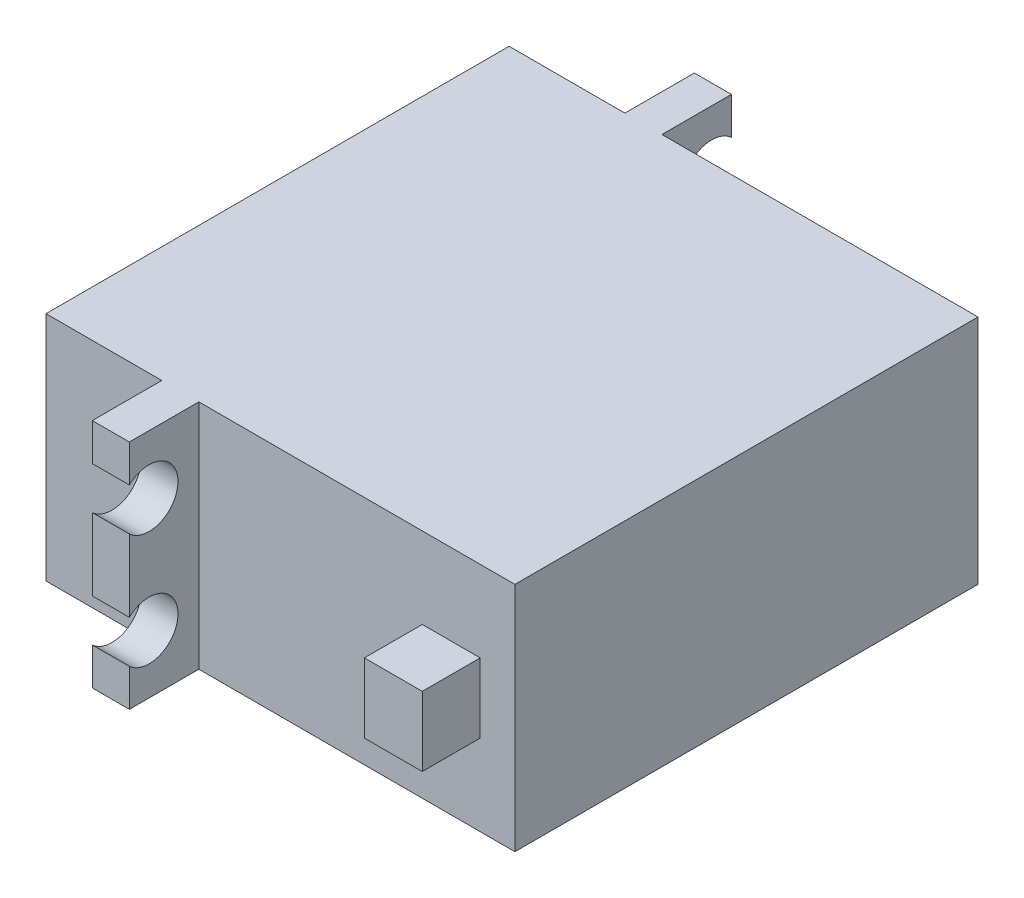
from build123d import *

# Parameters (mm, degrees)
BOSS_EXTRUDE1_START = 20.25
SKETCH2_W           = 40
SKETCH2_H           = 20
SKETCH2_R           = 3
BOSS_EXTRUDE1_DEPTH = 40.5
BOSS_EXTRUDE2_START = -7.05
BOSS_EXTRUDE2_DEPTH = 3.2
BOSS_EXTRUDE3_START = -20.25
SKETCH2_5_R         = 3
BOSS_EXTRUDE3_DEPTH = 5.5
SKETCH3_W           = 5
SKETCH3_H           = 6
BOSS_EXTRUDE4_DEPTH = 5


with BuildPart() as part:
    # Sketch2 → Boss-Extrude1 (new body)
    # profile 1 of 2: a face of its own
    with BuildSketch(Plane(origin=(0, 0, 0), x_dir=(0, 0, -1), z_dir=(1, 0, 0)).offset(BOSS_EXTRUDE1_START)):
        Rectangle(SKETCH2_W, SKETCH2_H)
        with Locations((-10.2, 0)):
            Circle(SKETCH2_R, mode=Mode.SUBTRACT)
    # profile 2 of 2: a face of its own
    with BuildSketch(Plane(origin=(0, 0, 0), x_dir=(0, 0, -1), z_dir=(1, 0, 0)).offset(BOSS_EXTRUDE1_START)):
        with Locations((-10.2, 0)):
            Circle(SKETCH2_R)
    extrude(amount=-BOSS_EXTRUDE1_DEPTH)

    # Sketch2<3> → Boss-Extrude2 (add)
    with BuildSketch(Plane(origin=(0, 0, 0), x_dir=(0, 0, -1), z_dir=(1, 0, 0)).offset(BOSS_EXTRUDE2_START)):
        with BuildLine():
            Line((-26, -10), (-20, -10))
            Line((-20, -10), (-20, 10))
            Line((-20, 10), (-26, 10))
            Line((-26, 10), (-26, 6.783030278))
            ThreePointArc((-26, 6.783030278), (-21.8, 4.95), (-26, 3.116969722))
            Line((-26, 3.116969722), (-26, -3.116969722))
            ThreePointArc((-26, -3.116969722), (-21.8, -4.95), (-26, -6.783030278))
            Line((-26, -6.783030278), (-26, -10))
        make_face()
        with BuildLine():
            Line((20, 10), (20, -10))
            Line((20, -10), (26, -10))
            Line((26, -10), (26, -6.783030278))
            ThreePointArc((26, -6.783030278), (21.8, -4.95), (26, -3.116969722))
            Line((26, -3.116969722), (26, 3.116969722))
            ThreePointArc((26, 3.116969722), (21.8, 4.95), (26, 6.783030278))
            Line((26, 6.783030278), (26, 10))
            Line((26, 10), (20, 10))
        make_face()
    extrude(amount=-BOSS_EXTRUDE2_DEPTH)

    # Sketch2<5> → Boss-Extrude3 (add)
    with BuildSketch(Plane(origin=(0, 0, 0), x_dir=(0, 0, -1), z_dir=(1, 0, 0)).offset(BOSS_EXTRUDE3_START)):
        with Locations((-10.2, 0)):
            Circle(SKETCH2_5_R)
    extrude(amount=-BOSS_EXTRUDE3_DEPTH)

    # Sketch3 → Boss-Extrude4 (add)
    with BuildSketch(Plane.XY.offset(20)):
        with Locations((14.75, 0)):
            Rectangle(SKETCH3_W, SKETCH3_H)
    extrude(amount=BOSS_EXTRUDE4_DEPTH)


solid = part.part
